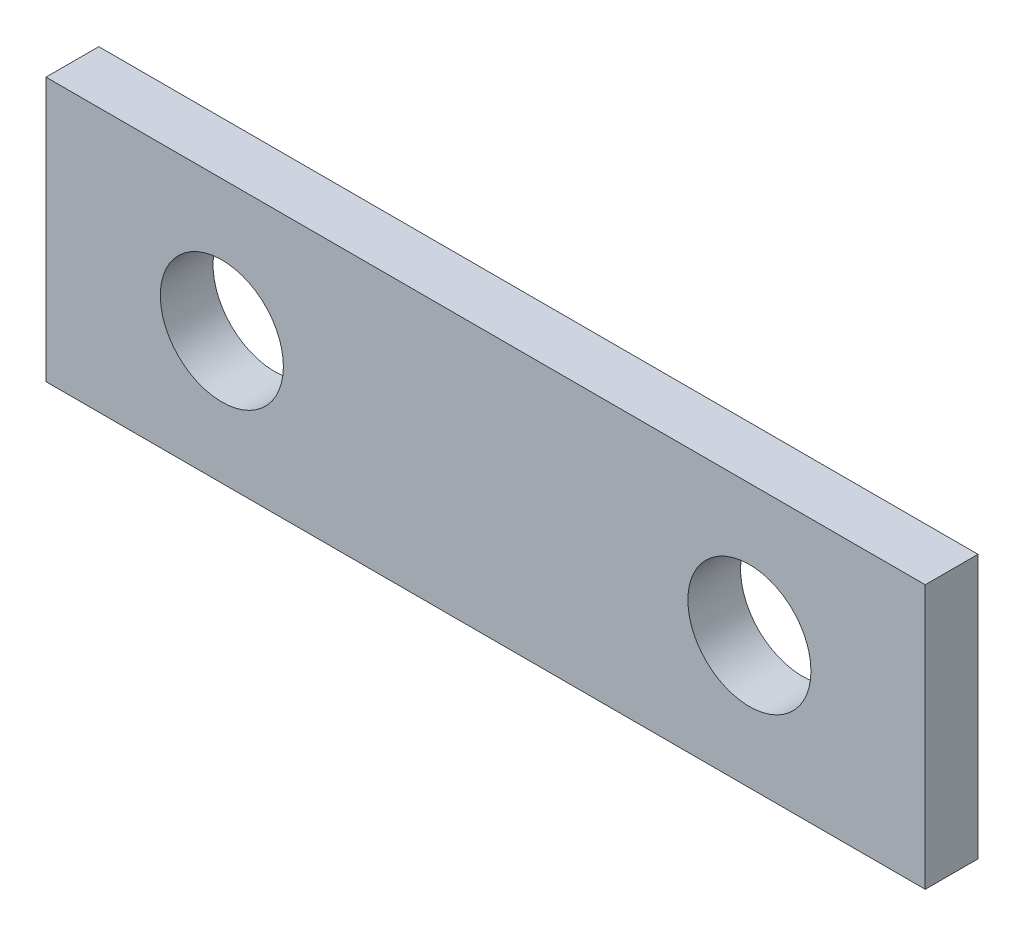
from build123d import *

# Parameters (mm, degrees)
SKETCH_1_W      = 100
SKETCH_1_H      = 30
SKETCH_1_R      = 7
EXTRUDE_1_DEPTH = 6


with BuildPart() as part:
    # 草图1 → 凸台-拉伸1 (new body)
    with BuildSketch(Plane.XY):
        with Locations((50, 15)):
            Rectangle(SKETCH_1_W, SKETCH_1_H)
        with Locations((20, 15)):
            Circle(SKETCH_1_R, mode=Mode.SUBTRACT)
        with Locations((80, 15)):
            Circle(SKETCH_1_R, mode=Mode.SUBTRACT)
    extrude(amount=EXTRUDE_1_DEPTH)


solid = part.part
